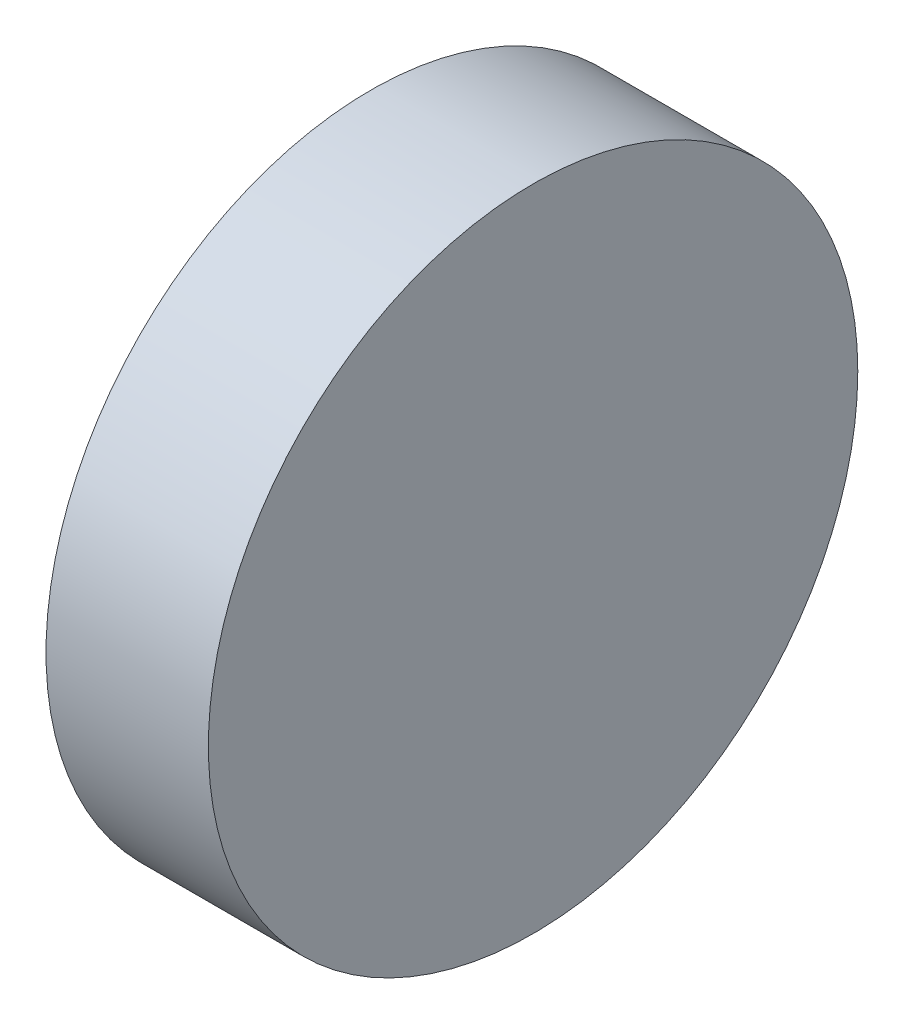
from build123d import *

# Parameters (mm, degrees)
SKETCH1_R           = 25.4
BOSS_EXTRUDE1_DEPTH = 12.7


with BuildPart() as part:
    # Sketch1 → Boss-Extrude1 (new body)
    with BuildSketch(Plane(origin=(0, 0, 0), x_dir=(0, 0, -1), z_dir=(1, 0, 0))):
        Circle(SKETCH1_R)
    extrude(amount=BOSS_EXTRUDE1_DEPTH)


solid = part.part
